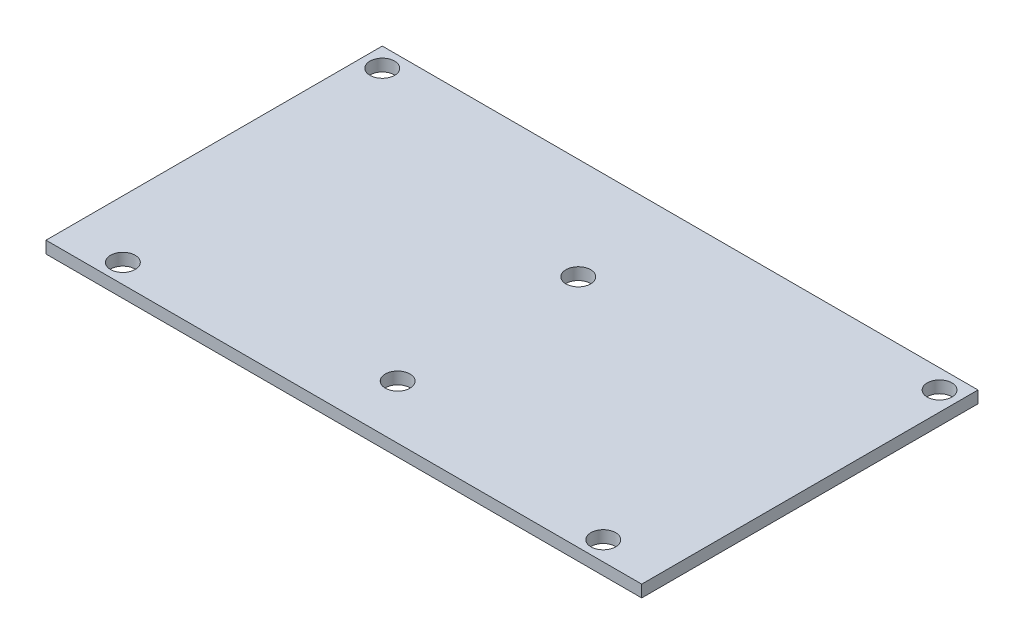
from build123d import *

# Parameters (mm, degrees)
SKETCH1_W             = 78.74
SKETCH1_H             = 44.45
BOSS_EXTRUDE1_DEPTH   = 1.5875
F_4_CLEARANCE_HOLE1_D = 3.2639
F_4_CLEARANCE_HOLE2_D = 3.2639


with BuildPart() as part:
    # Sketch1 → Boss-Extrude1 (new body)
    with BuildSketch(Plane(origin=(0, 0, 0), x_dir=(1, 0, 0), z_dir=(0, 1, 0))):
        Rectangle(SKETCH1_W, SKETCH1_H)
    extrude(amount=BOSS_EXTRUDE1_DEPTH)

    # #4 Clearance Hole1 (through all)
    with Locations(Plane(origin=(0, 1.5875, 0), x_dir=(1, 0, 0), z_dir=(0, 1, 0))):
        with Locations((-36.83, 19.685), (36.83, 19.685), (31.75, -19.685), (-31.75, -19.685)):
            Hole(F_4_CLEARANCE_HOLE1_D / 2)

    # #4 Clearance Hole2 (through all)
    with Locations(Plane(origin=(0, 1.5875, 0), x_dir=(1, 0, 0), z_dir=(0, 1, 0))):
        with Locations((0, 8.762995682), (0, -15.113004318)):
            Hole(F_4_CLEARANCE_HOLE2_D / 2)


solid = part.part
